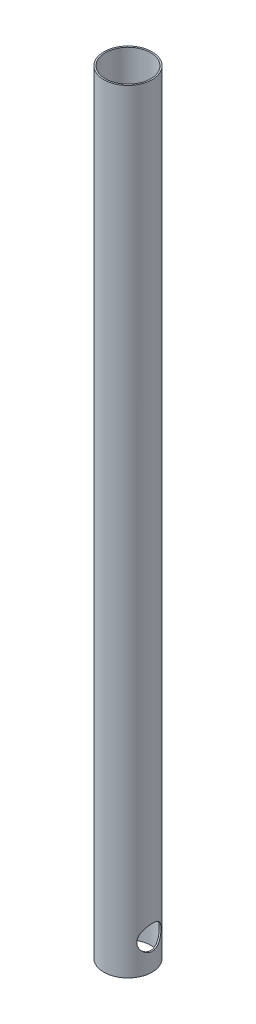
from build123d import *

# Parameters (mm, degrees)
SKETCH1_R           = 25.4
BOSS_EXTRUDE1_DEPTH = 406.4
SHELL1_T            = -1.5875
SKETCH2_R           = 12.7
CUT_EXTRUDE1_DEPTH  = 411.349558304


with BuildPart() as part:
    # Sketch1 → Boss-Extrude1 (new, symmetric)
    with BuildSketch(Plane(origin=(0, 0, 0), x_dir=(1, 0, 0), z_dir=(0, 1, 0))):
        with Locations(Location((0, 0, 0), (0, 0, 270))):
            Circle(SKETCH1_R)
    extrude(amount=BOSS_EXTRUDE1_DEPTH, both=True)

    # Shell1
    shell1_openings = [part.faces().sort_by_distance(p)[0] for p in [
        (0, 406.4, 0),
        (0, -406.4, 0),
    ]]
    offset(amount=SHELL1_T, openings=shell1_openings, kind=Kind.INTERSECTION)

    # Sketch2 → Cut-Extrude1 (cut, through all)
    with BuildSketch(Plane(origin=(25.4, 0, 0), x_dir=(0, 0, -1), z_dir=(1, 0, 0))):
        with Locations((0, -374.65)):
            Circle(SKETCH2_R)
    extrude(amount=-CUT_EXTRUDE1_DEPTH, mode=Mode.SUBTRACT)


solid = part.part
